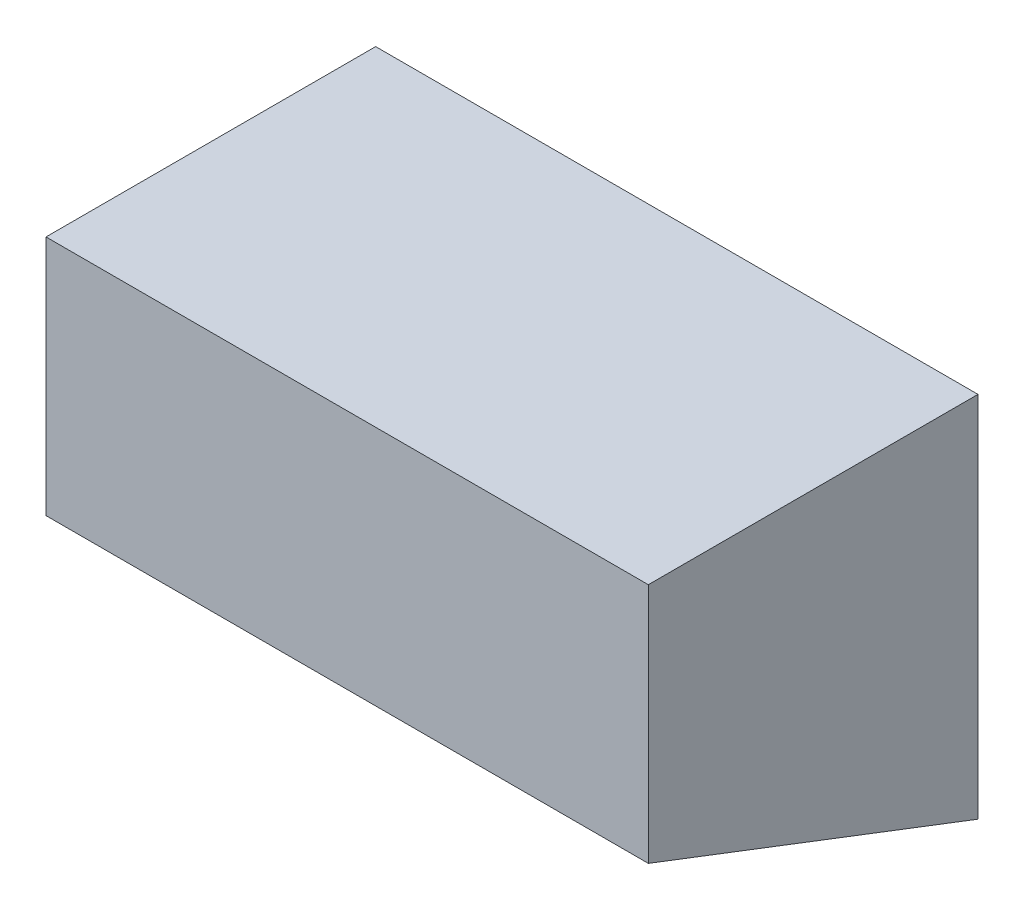
from build123d import *

# Parameters (mm, degrees)
BOSS_EXTRUDE1_DEPTH = 37


with BuildPart() as part:
    # Sketch1 → Boss-Extrude1 (new, symmetric)
    with BuildSketch(Plane(origin=(0, 0, 0), x_dir=(0, 0, -1), z_dir=(1, 0, 0))):
        Polygon((0, 0), (-40.5, 15.546493419), (-40.5, 45.2), (0, 45.2), align=None)
    extrude(amount=BOSS_EXTRUDE1_DEPTH, both=True)


solid = part.part
